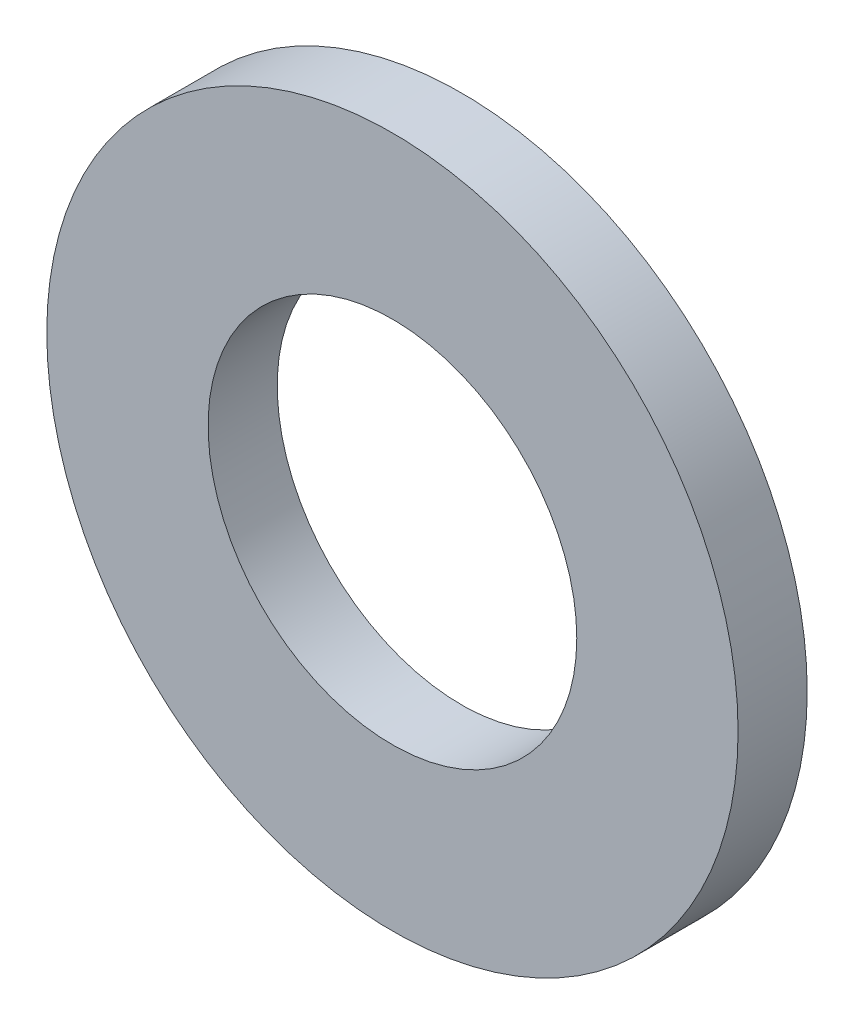
from build123d import *

# Parameters (mm, degrees)
SKETCH2_R          = 7.5
SKETCH2_R_2        = 4
BODY_EXTRUDE_DEPTH = 0.75


with BuildPart() as part:
    # Sketch2 → Body Extrude (new, symmetric)
    with BuildSketch(Plane.XY):
        Circle(SKETCH2_R)
        Circle(SKETCH2_R_2, mode=Mode.SUBTRACT)
    extrude(amount=BODY_EXTRUDE_DEPTH, both=True)


solid = part.part
